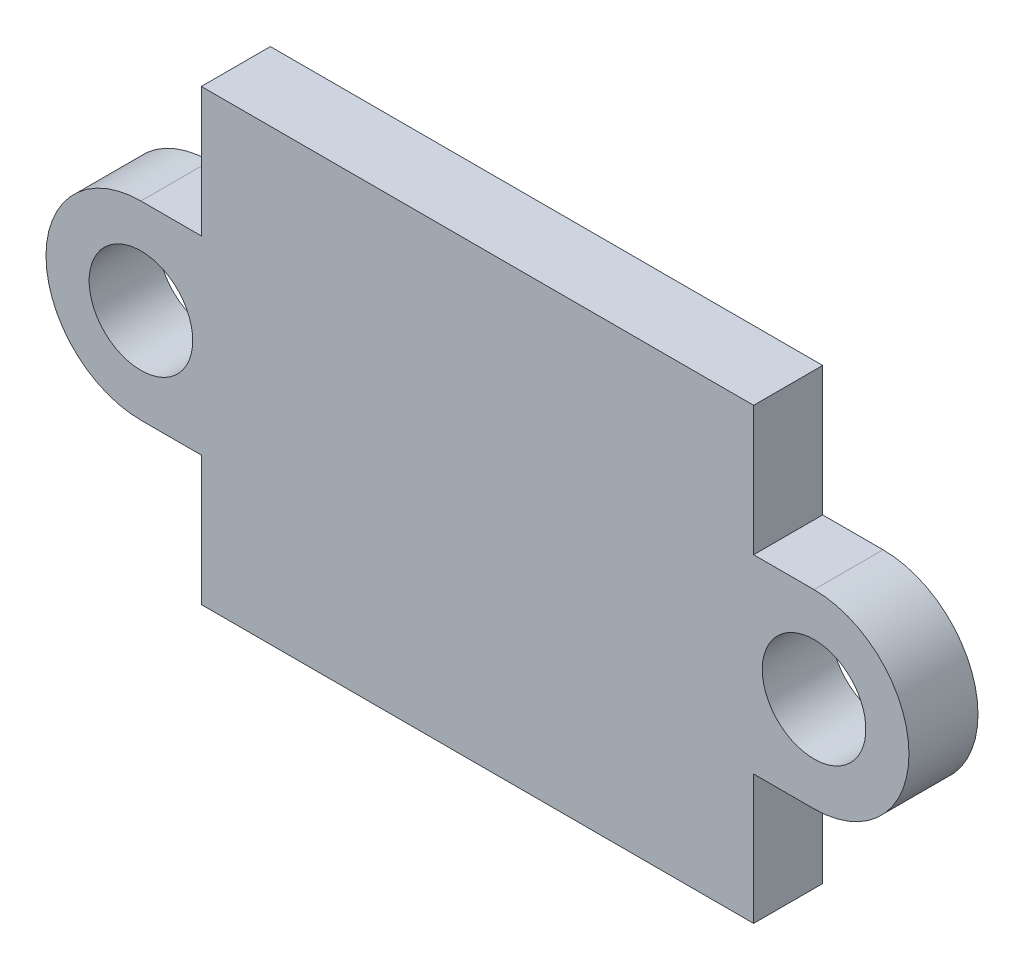
from build123d import *

# Parameters (mm, degrees)
SKETCH1_W           = 16
SKETCH1_H           = 13
BOSS_EXTRUDE1_DEPTH = 1
SKETCH2_R           = 1.5
BOSS_EXTRUDE2_DEPTH = 1


with BuildPart() as part:
    # Sketch1 → Boss-Extrude1 (new, symmetric)
    with BuildSketch(Plane.XY):
        Rectangle(SKETCH1_W, SKETCH1_H)
    extrude(amount=BOSS_EXTRUDE1_DEPTH, both=True)

    # Sketch2 → Boss-Extrude2 (add, symmetric)
    # profile 1 of 2: a face of its own
    with BuildSketch(Plane.XY):
        with BuildLine():
            Line((-9.75, 2.75), (-8, 2.75))
            Line((-8, 2.75), (-8, -2.75))
            Line((-8, -2.75), (-9.75, -2.75))
            ThreePointArc((-9.75, -2.75), (-12.5, 0), (-9.75, 2.75))
        make_face()
        with Locations((-9.75, 0)):
            Circle(SKETCH2_R, mode=Mode.SUBTRACT)
    # profile 2 of 2: a face of its own
    with BuildSketch(Plane.XY):
        with BuildLine():
            Line((9.75, -2.75), (8, -2.75))
            Line((8, -2.75), (8, 2.75))
            Line((8, 2.75), (9.75, 2.75))
            ThreePointArc((9.75, 2.75), (12.5, 0), (9.75, -2.75))
        make_face()
        with Locations(Location((9.75, 0, 0), (0, 0, 180))):
            Circle(SKETCH2_R, mode=Mode.SUBTRACT)
    extrude(amount=BOSS_EXTRUDE2_DEPTH, both=True)


solid = part.part
